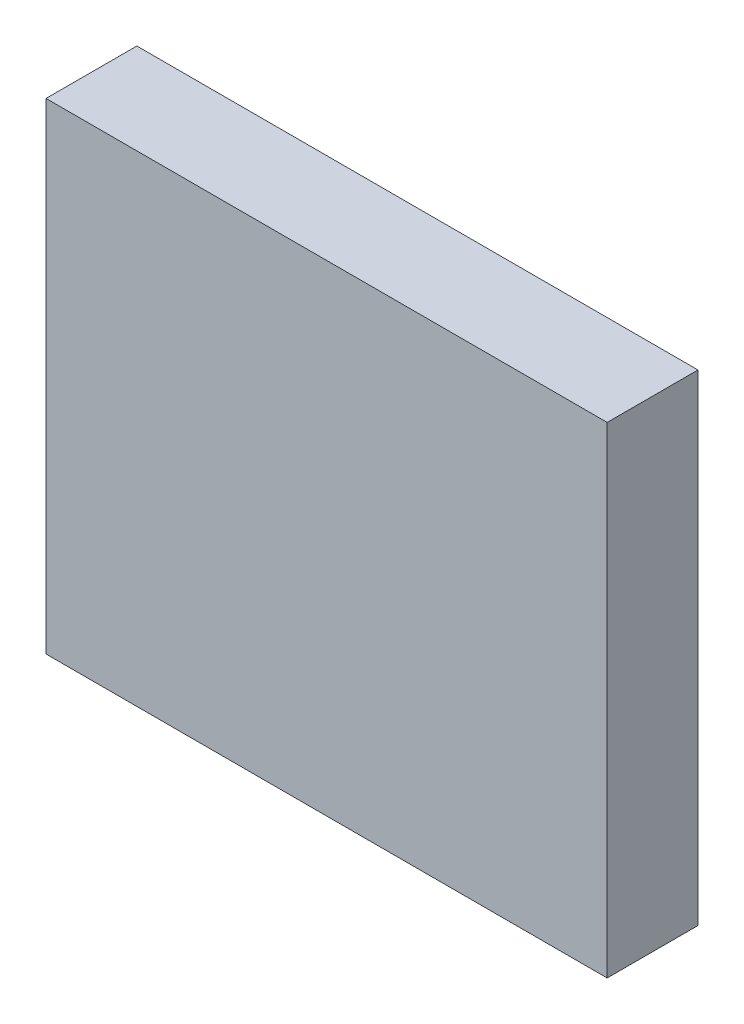
from build123d import *

# Parameters (mm, degrees)
ESBO_O1_W                = 61.792048588
ESBO_O1_H                = 52.985054764
RESSALTO_EXTRUS_O1_DEPTH = 5


with BuildPart() as part:
    # Esboço1 → Ressalto-extrusão1 (new, symmetric)
    with BuildSketch(Plane.XY):
        Rectangle(ESBO_O1_W, ESBO_O1_H)
    extrude(amount=RESSALTO_EXTRUS_O1_DEPTH, both=True)


solid = part.part
